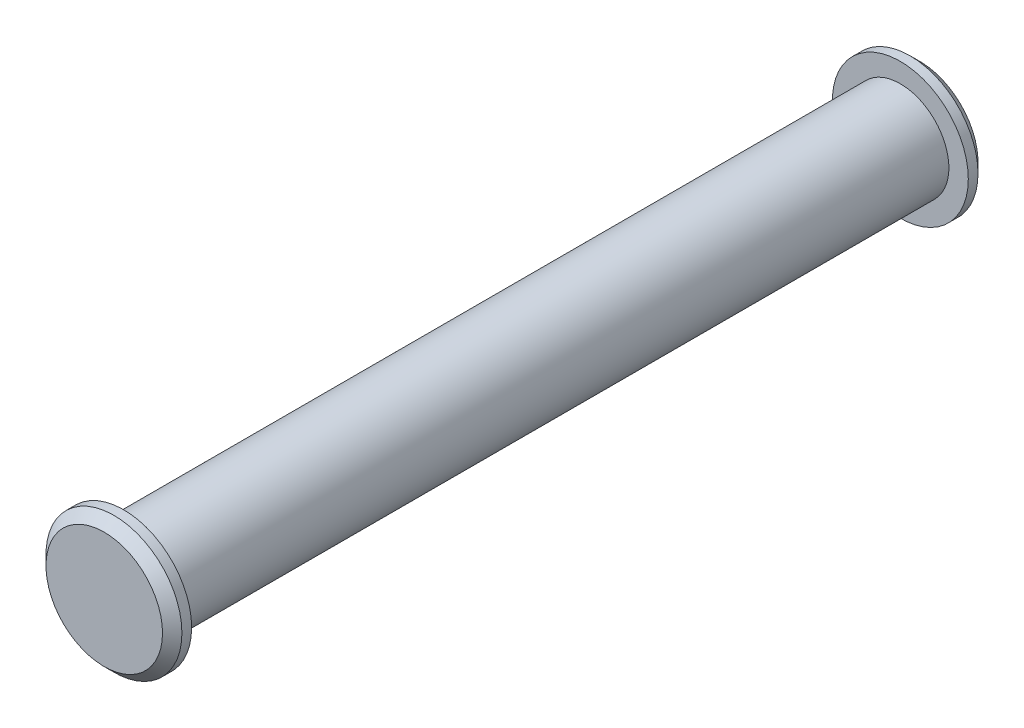
from build123d import *

# Parameters (mm, degrees)
SKETCH1_R           = 2.5
BOSS_EXTRUDE1_DEPTH = 20
SKETCH2_R           = 3.5
BOSS_EXTRUDE2_DEPTH = 1
CHAMFER1_SIZE       = 0.5


with BuildPart() as part:
    # Sketch1 → Boss-Extrude1 (new, symmetric)
    with BuildSketch(Plane.XY):
        Circle(SKETCH1_R)
    extrude(amount=BOSS_EXTRUDE1_DEPTH, both=True)

    # Sketch2 → Boss-Extrude2 (add)
    with BuildSketch(Plane.XY.offset(20)):
        Circle(SKETCH2_R)
    boss_extrude2 = extrude(amount=BOSS_EXTRUDE2_DEPTH)

    # Mirror1: Boss-Extrude2 across plane
    add(boss_extrude2.mirror(Plane.XY))

    # Chamfer1
    chamfer1_edges = [part.edges().sort_by_distance(p)[0] for p in [
        (-3.5, 0, 21),
        (-3.5, 0, -21),
    ]]
    chamfer(chamfer1_edges, length=CHAMFER1_SIZE)


solid = part.part
